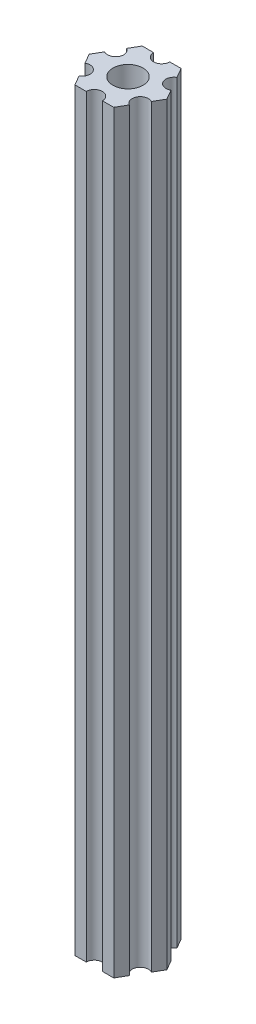
from build123d import *

# Parameters (mm, degrees)
ESBO_O1_R                = 2.79
RESSALTO_EXTRUS_O1_DEPTH = 140


with BuildPart() as part:
    # Esboço1 → Ressalto-extrusão1 (new body)
    with BuildSketch(Plane(origin=(0, 85, 0), x_dir=(1, 0, 0), z_dir=(0, 1, 0))):
        with BuildLine():
            Line((6.162658774, -1.825961894), (7.216878365, 0))
            Line((7.216878365, 0), (6.162658774, 1.825961894))
            ThreePointArc((6.162658774, 1.825961894), (4.113620668, 2.375), (4.662658774, 4.424038106))
            Line((4.662658774, 4.424038106), (3.608439182, 6.25))
            Line((3.608439182, 6.25), (1.5, 6.25))
            ThreePointArc((1.5, 6.25), (0, 4.75), (-1.5, 6.25))
            Line((-1.5, 6.25), (-3.608439182, 6.25))
            Line((-3.608439182, 6.25), (-4.662658774, 4.424038106))
            ThreePointArc((-4.662658774, 4.424038106), (-4.113620668, 2.375), (-6.162658774, 1.825961894))
            Line((-6.162658774, 1.825961894), (-7.216878365, 0))
            Line((-7.216878365, 0), (-6.162658774, -1.825961894))
            ThreePointArc((-6.162658774, -1.825961894), (-4.113620668, -2.375), (-4.662658774, -4.424038106))
            Line((-4.662658774, -4.424038106), (-3.608439182, -6.25))
            Line((-3.608439182, -6.25), (-1.5, -6.25))
            ThreePointArc((-1.5, -6.25), (0, -4.75), (1.5, -6.25))
            Line((1.5, -6.25), (3.608439182, -6.25))
            Line((3.608439182, -6.25), (4.662658774, -4.424038106))
            ThreePointArc((4.662658774, -4.424038106), (4.113620668, -2.375), (6.162658774, -1.825961894))
        make_face()
        with Locations(Location((0, 0, 0), (0, 0, 90))):
            Circle(ESBO_O1_R, mode=Mode.SUBTRACT)
    extrude(amount=-RESSALTO_EXTRUS_O1_DEPTH)


solid = part.part
